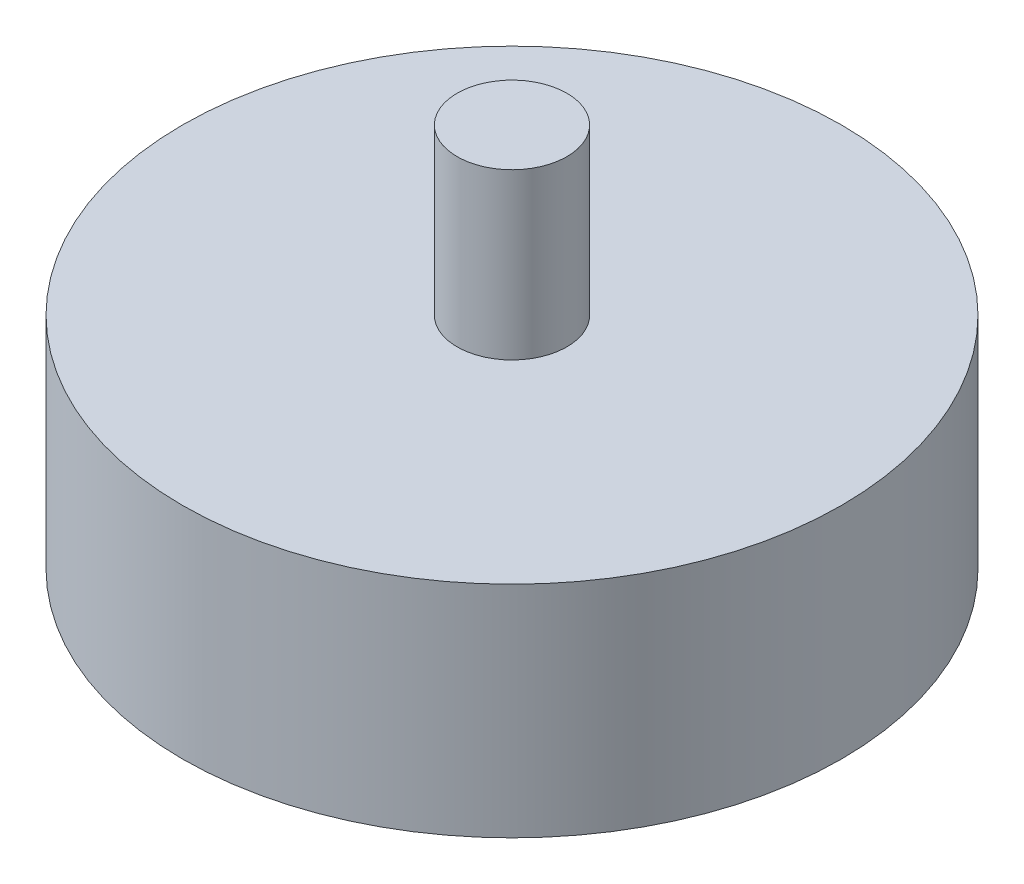
from build123d import *

# Parameters (mm, degrees)
SKETCH1_R           = 5
BOSS_EXTRUDE1_DEPTH = 45
BOSS_EXTRUDE2_START = 10
SKETCH2_R           = 30
BOSS_EXTRUDE2_DEPTH = 20


with BuildPart() as part:
    # Sketch1 → Boss-Extrude1 (new body)
    with BuildSketch(Plane(origin=(0, 0, 0), x_dir=(1, 0, 0), z_dir=(0, 1, 0))):
        with Locations(Location((0, 0, 0), (0, 0, 90))):
            Circle(SKETCH1_R)
    extrude(amount=BOSS_EXTRUDE1_DEPTH)

    # Sketch2 → Boss-Extrude2 (add)
    with BuildSketch(Plane(origin=(0, 0, 0), x_dir=(1, 0, 0), z_dir=(0, 1, 0)).offset(BOSS_EXTRUDE2_START)):
        with Locations(Location((0, 0, 0), (0, 0, 270))):
            Circle(SKETCH2_R)
    extrude(amount=BOSS_EXTRUDE2_DEPTH)


solid = part.part
